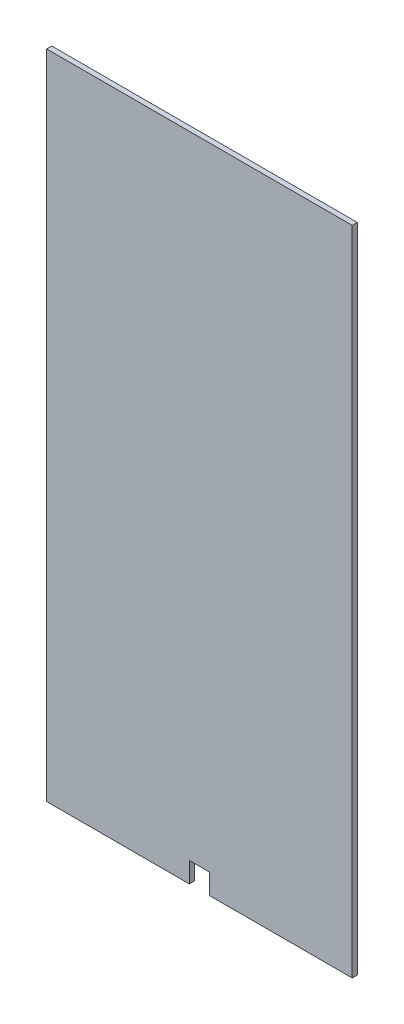
from build123d import *

# Parameters (mm, degrees)
AUFSATZ_LINEAR_AUSTRAGEN1_DEPTH = 10


with BuildPart() as part:
    # Skizze1 → Aufsatz-Linear austragen1 (new body)
    with BuildSketch(Plane.XY):
        Polygon((20, 40), (-20, 40), (-20, 0), (-300, 0), (-300, 1280), (300, 1280), (300, 0), (20, 0), align=None)
    extrude(amount=AUFSATZ_LINEAR_AUSTRAGEN1_DEPTH)


solid = part.part
